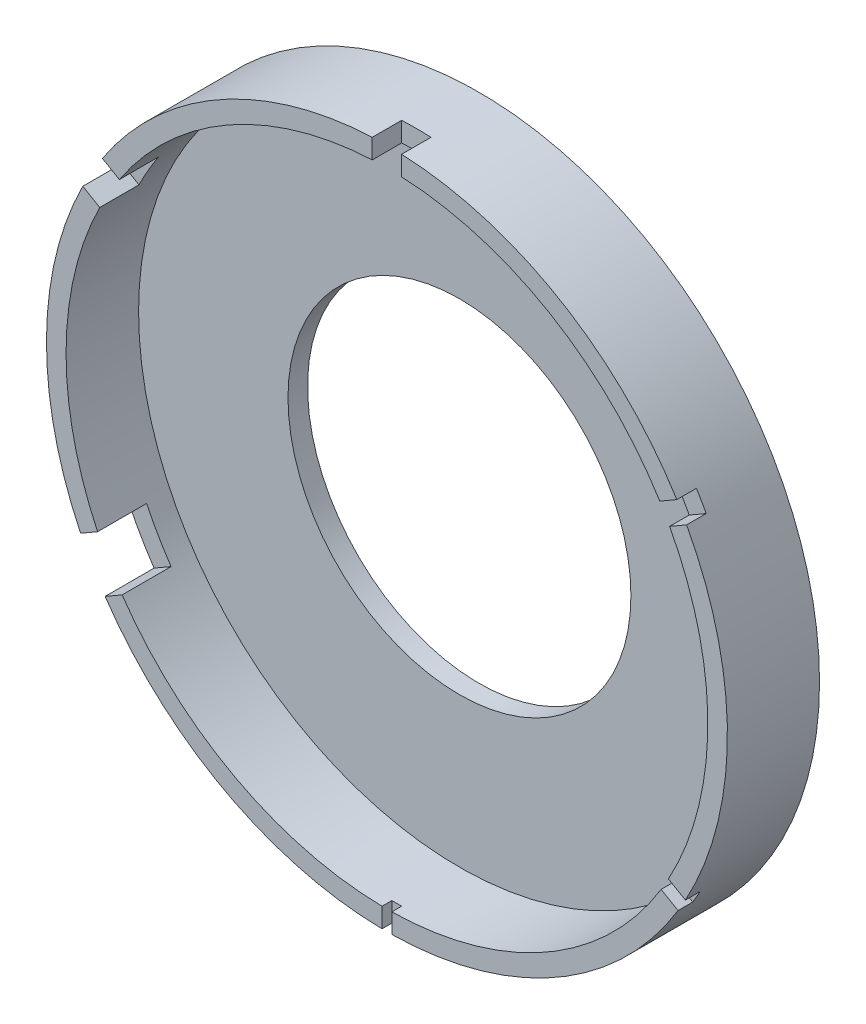
from build123d import *

# Parameters (mm, degrees)
ESQUISSE1_R                  = 34.75
ESQUISSE1_R_2                = 32.75
BOSS_EXTRU_1_DEPTH           = 9.4
ESQUISSE2_R                  = 34.75
BOSS_EXTRU_2_DEPTH           = 2
ESQUISSE3_W                  = 1
ESQUISSE3_H                  = 2.5
ENL_V_MAT_EXTRU_1_DEPTH      = 1
ENL_V_MAT_EXTRU_2_DEPTH      = 1.5
ENL_V_MAT_EXTRU_3_DEPTH      = 2
ESQUISSE6_W                  = 3
ESQUISSE6_H                  = 2.5
ENL_V_MAT_EXTRU_4_DEPTH      = 3
ENL_V_MAT_EXTRU_5_DEPTH      = 4
ENL_V_MAT_EXTRU_6_DEPTH      = 5
ENL_V_MAT_EXTRU_7_DEPTH      = 50.697937583
ENL_V_MAT_EXTRU_7_DEPTH_BACK = 50.697937583
ESQUISSE9_R                  = 17.5


with BuildPart() as part:
    # Esquisse1 → Boss.-Extru.1 (new body)
    with BuildSketch(Plane.XY):
        Circle(ESQUISSE1_R)
        Circle(ESQUISSE1_R_2, mode=Mode.SUBTRACT)
    extrude(amount=BOSS_EXTRU_1_DEPTH)

    # Esquisse2 → Boss.-Extru.2 (add)
    with BuildSketch(Plane(origin=(0, 0, 0), x_dir=(-1, 0, 0), z_dir=(0, 0, -1))):
        with Locations(Location((0, 0, 0), (0, 0, 180))):
            Circle(ESQUISSE2_R)
    extrude(amount=-BOSS_EXTRU_2_DEPTH)

    # Esquisse3 → Enlèv. mat.-Extru.1 (cut)
    with BuildSketch(Plane.XY.offset(9.4)):
        with Locations((0, -33.996182984)):
            Rectangle(ESQUISSE3_W, ESQUISSE3_H)
    extrude(amount=-ENL_V_MAT_EXTRU_1_DEPTH, mode=Mode.SUBTRACT)

    # Esquisse4 → Enlèv. mat.-Extru.2 (cut)
    with BuildSketch(Plane.XY.offset(9.4)):
        Polygon((28.729893758, -15.721186491), (27.979893758, -17.020224597), (30.144957267, -18.270224597), (30.894957267, -16.971186491), align=None)
    extrude(amount=-ENL_V_MAT_EXTRU_2_DEPTH, mode=Mode.SUBTRACT)

    # Esquisse5 → Enlèv. mat.-Extru.3 (cut)
    with BuildSketch(Plane.XY.offset(9.4)):
        Polygon((27.849107129, 17.233390036), (28.849107129, 15.501339228), (31.014170638, 16.751339228), (30.014170638, 18.483390036), align=None)
    extrude(amount=-ENL_V_MAT_EXTRU_3_DEPTH, mode=Mode.SUBTRACT)

    # Esquisse6 → Enlèv. mat.-Extru.4 (cut)
    with BuildSketch(Plane.XY.offset(9.4)):
        with Locations((0, 33.965630821)):
            Rectangle(ESQUISSE6_W, ESQUISSE6_H)
    extrude(amount=-ENL_V_MAT_EXTRU_4_DEPTH, mode=Mode.SUBTRACT)

    # Esquisse7 → Enlèv. mat.-Extru.5 (cut)
    with BuildSketch(Plane.XY.offset(9.4)):
        Polygon((-29.309395525, 14.612386319), (-27.309395525, 18.076487935), (-29.474459035, 19.326487935), (-31.474459035, 15.862386319), align=None)
    extrude(amount=-ENL_V_MAT_EXTRU_5_DEPTH, mode=Mode.SUBTRACT)

    # Esquisse8 → Enlèv. mat.-Extru.6 (cut)
    with BuildSketch(Plane.XY.offset(9.4)):
        Polygon((-27.029575227, -18.492283879), (-29.529575227, -14.16215686), (-31.694638736, -15.41215686), (-29.194638736, -19.742283879), align=None)
    extrude(amount=-ENL_V_MAT_EXTRU_6_DEPTH, mode=Mode.SUBTRACT)

    # Esquisse9 → Enlèv. mat.-Extru.7 (cut, two sides: drawn at the far end of the back side and taken through both)
    with BuildSketch(Plane.XY.offset(2).offset(-ENL_V_MAT_EXTRU_7_DEPTH_BACK)):
        Circle(ESQUISSE9_R)
    extrude(amount=ENL_V_MAT_EXTRU_7_DEPTH + ENL_V_MAT_EXTRU_7_DEPTH_BACK, mode=Mode.SUBTRACT)


solid = part.part
